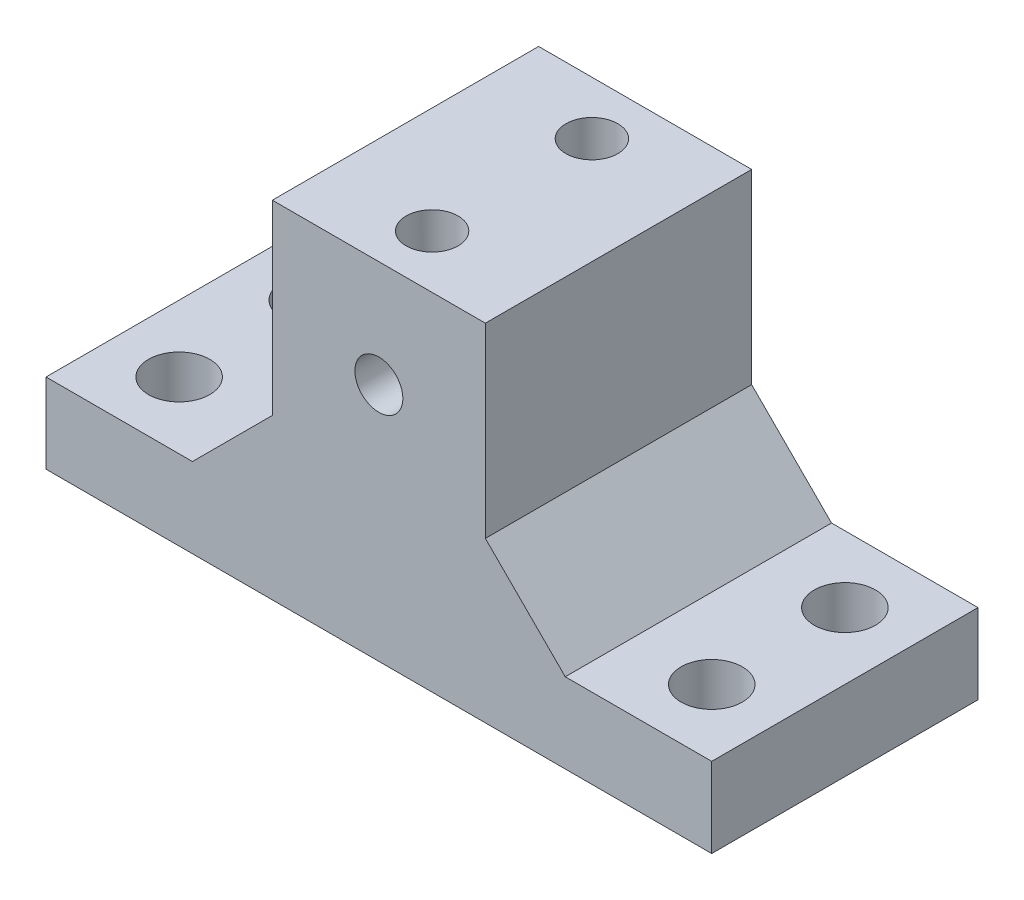
from build123d import *

# Parameters (mm, degrees)
SKETCH1_W           = 25
SKETCH1_H           = 10
SKETCH1_R           = 1.15
BOSS_EXTRUDE1_DEPTH = 3
SKETCH3_W           = 8
SKETCH3_H           = 13
BOSS_EXTRUDE2_DEPTH = 10
SKETCH4_R           = 0.9
CUT_EXTRUDE1_DEPTH  = 21.621590627
SKETCH5_R           = 0.975
CUT_EXTRUDE2_DEPTH  = 3.5
CHAMFER1_SIZE       = 3


with BuildPart() as part:
    # Sketch1 → Boss-Extrude1 (new body)
    with BuildSketch(Plane(origin=(0, 0, 0), x_dir=(1, 0, 0), z_dir=(0, 1, 0))):
        Rectangle(SKETCH1_W, SKETCH1_H)
        with Locations(Location((-10, 2.5, 0), (0, 0, 270))):
            Circle(SKETCH1_R, mode=Mode.SUBTRACT)
        with Locations(Location((-10, -2.5, 0), (0, 0, 270))):
            Circle(SKETCH1_R, mode=Mode.SUBTRACT)
        with Locations(Location((10, 2.5, 0), (0, 0, 270))):
            Circle(SKETCH1_R, mode=Mode.SUBTRACT)
        with Locations(Location((10, -2.5, 0), (0, 0, 270))):
            Circle(SKETCH1_R, mode=Mode.SUBTRACT)
    extrude(amount=BOSS_EXTRUDE1_DEPTH)

    # Sketch3 → Boss-Extrude2 (add)
    with BuildSketch(Plane(origin=(0, 0, -5), x_dir=(-1, 0, 0), z_dir=(0, 0, -1))):
        with Locations((0, 6.5)):
            Rectangle(SKETCH3_W, SKETCH3_H)
    extrude(amount=-BOSS_EXTRUDE2_DEPTH)

    # Sketch4 → Cut-Extrude1 (cut, through all)
    with BuildSketch(Plane(origin=(0, 0, -5), x_dir=(-1, 0, 0), z_dir=(0, 0, -1))):
        with Locations((0, 9)):
            Circle(SKETCH4_R)
    extrude(amount=-CUT_EXTRUDE1_DEPTH, mode=Mode.SUBTRACT)

    # Sketch5 → Cut-Extrude2 (cut)
    with BuildSketch(Plane(origin=(0, 13, 0), x_dir=(1, 0, 0), z_dir=(0, 1, 0))):
        with Locations(Location((0, 3, 0), (0, 0, 180))):
            Circle(SKETCH5_R)
        with Locations(Location((0, -3, 0), (0, 0, 180))):
            Circle(SKETCH5_R)
    extrude(amount=-CUT_EXTRUDE2_DEPTH, mode=Mode.SUBTRACT)

    # Chamfer1
    chamfer1_edges = [part.edges().sort_by_distance(p)[0] for p in [
        (4, 3, 0),
        (-4, 3, 0),
    ]]
    chamfer(chamfer1_edges, length=CHAMFER1_SIZE)


solid = part.part
